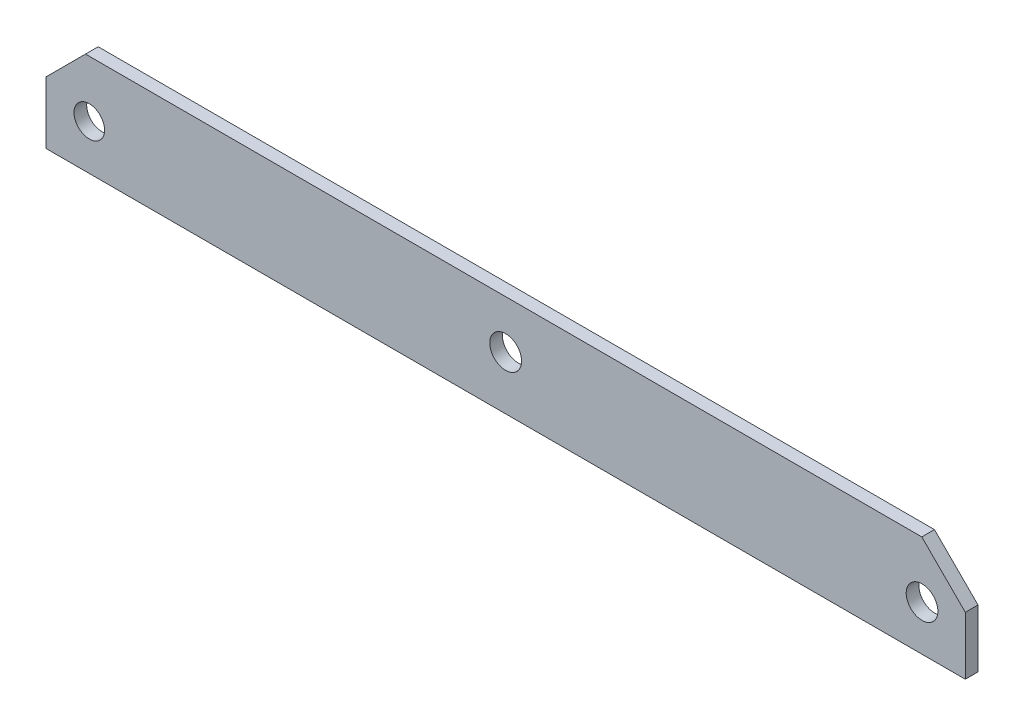
from build123d import *

# Parameters (mm, degrees)
SKETCH2_R           = 3.824987574
SKETCH2_R_2         = 3.960069723
SKETCH2_R_3         = 3.979490197
BOSS_EXTRUDE1_DEPTH = 3.175


with BuildPart() as part:
    # Sketch2 → Boss-Extrude1 (new body)
    with BuildSketch(Plane.XY):
        Polygon((9.878524394, 25.4), (0, 15.521475606), (0, 0), (230, 0), (230, 14.509954572), (219.109954572, 25.4), align=None)
        with Locations((10.82729629, 11.29561028)):
            Circle(SKETCH2_R, mode=Mode.SUBTRACT)
        with Locations((219.17270371, 11.29561028)):
            Circle(SKETCH2_R_2, mode=Mode.SUBTRACT)
        with Locations((115, 13.4)):
            Circle(SKETCH2_R_3, mode=Mode.SUBTRACT)
    extrude(amount=BOSS_EXTRUDE1_DEPTH)


solid = part.part
